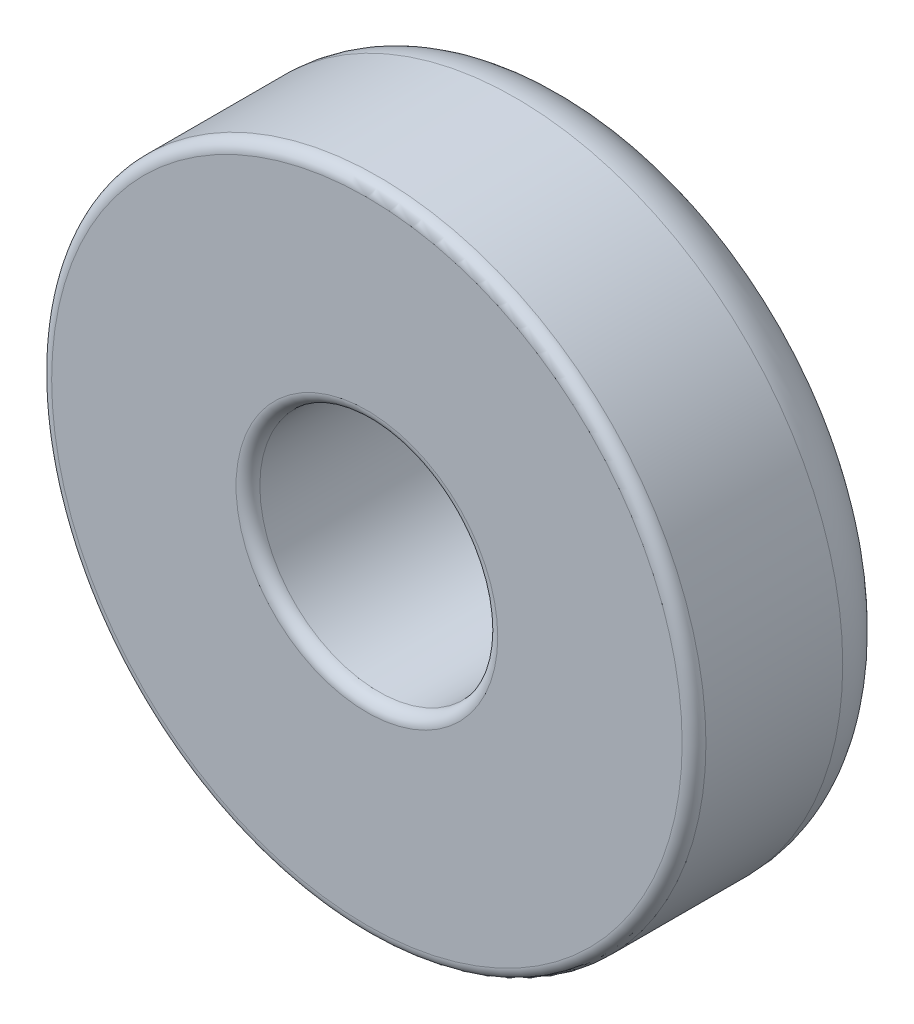
from build123d import *

# Parameters (mm, degrees)
SKETCH1_R           = 2.75
SKETCH1_R_2         = 1
EXTRUDE_THIN1_DEPTH = 1.75
FILLET1_R           = 0.5
FILLET2_R           = 0.1


with BuildPart() as part:
    # Sketch1 → Extrude-Thin1 (new body)
    with BuildSketch(Plane.XY):
        with Locations((0, 0.100943749)):
            Circle(SKETCH1_R)
        with Locations((0, 0.100943749)):
            Circle(SKETCH1_R_2, mode=Mode.SUBTRACT)
    extrude(amount=EXTRUDE_THIN1_DEPTH)

    # Fillet1
    fillet1_edges = [part.edges().sort_by_distance(p)[0] for p in [
        (-2.75, 0.100943749, 0),
    ]]
    fillet(fillet1_edges, radius=FILLET1_R)

    # Fillet2
    fillet2_edges = [part.edges().sort_by_distance(p)[0] for p in [
        (-1, 0.100943749, 0),
        (-2.75, 0.100943749, 1.75),
        (-1, 0.100943749, 1.75),
    ]]
    fillet(fillet2_edges, radius=FILLET2_R)


solid = part.part
